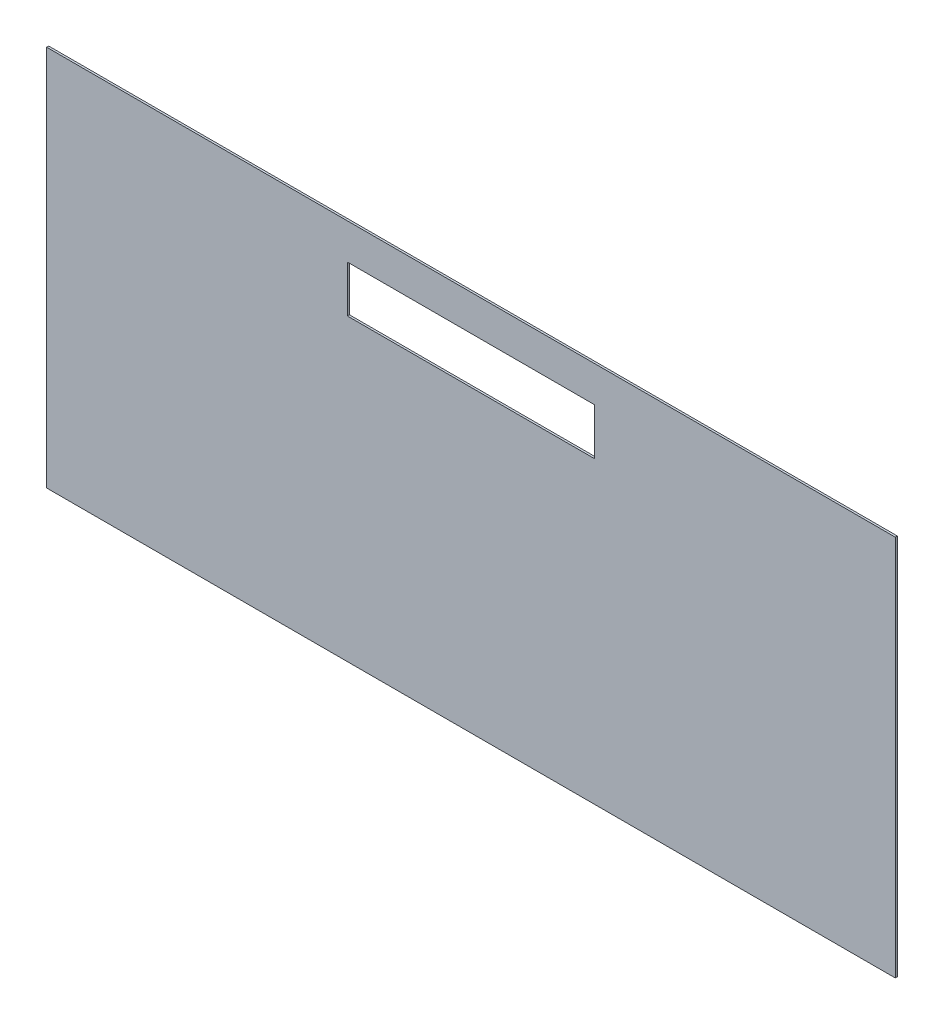
from build123d import *

# Parameters (mm, degrees)
STORE_KLAPE_KASET_KATI_ON_DIS_SAC_1_START = 38.5
SKETCH1_W                                 = 618
SKETCH1_H                                 = 278
STORE_KLAPE_KASET_KATI_ON_DIS_SAC_1_DEPTH = 1.5
STORE_KLAPE_KASET_KATI_ON_DIS_SAC_2_START = 27
SKETCH2_W                                 = 180
SKETCH2_H                                 = 34
STORE_KLAPE_KASET_KATI_ON_DIS_SAC_2_DEPTH = 14


with BuildPart() as part:
    # Sketch1 → STORE_klape_kaset_kati_on_dis_sac_1 (new body)
    with BuildSketch(Plane.XY.offset(STORE_KLAPE_KASET_KATI_ON_DIS_SAC_1_START)):
        with Locations((378, 545)):
            Rectangle(SKETCH1_W, SKETCH1_H)
    extrude(amount=STORE_KLAPE_KASET_KATI_ON_DIS_SAC_1_DEPTH)

    # Sketch2 → STORE_klape_kaset_kati_on_dis_sac_2 (cut)
    with BuildSketch(Plane.XY.offset(STORE_KLAPE_KASET_KATI_ON_DIS_SAC_2_START)):
        with Locations((378, 641)):
            Rectangle(SKETCH2_W, SKETCH2_H)
    extrude(amount=STORE_KLAPE_KASET_KATI_ON_DIS_SAC_2_DEPTH, mode=Mode.SUBTRACT)


solid = part.part
